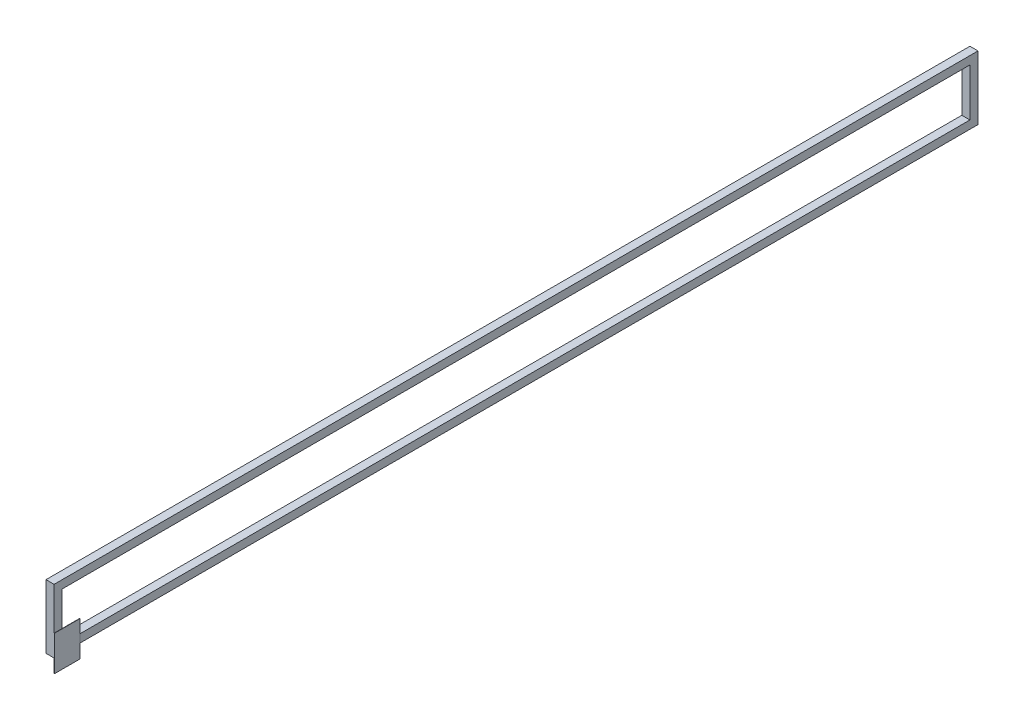
from build123d import *

# Parameters (mm, degrees)
CROQUIS1_W              = 50.8
CROQUIS1_H              = 50.8
SALIENTE_EXTRUIR1_DEPTH = 5800
CROQUIS4_W              = 160
CROQUIS4_H              = 220
SALIENTE_EXTRUIR4_DEPTH = 1.9
SALIENTE_EXTRUIR5_DEPTH = 50.8
CROQUIS7_W              = 50.8
CROQUIS7_H              = 299.2
SALIENTE_EXTRUIR7_DEPTH = 50.8


with BuildPart() as part:
    # Croquis1 → Saliente-Extruir1 (new body)
    with BuildSketch(Plane.XY):
        Rectangle(CROQUIS1_W, CROQUIS1_H)
    extrude(amount=SALIENTE_EXTRUIR1_DEPTH)

    # Croquis4 → Saliente-Extruir4 (add)
    with BuildSketch(Plane(origin=(25.4, 0, 0), x_dir=(0, 0, -1), z_dir=(1, 0, 0))):
        with Locations((-5720, 0)):
            Rectangle(CROQUIS4_W, CROQUIS4_H)
    extrude(amount=SALIENTE_EXTRUIR4_DEPTH)

    # Croquis5 → Saliente-Extruir5 (add)
    with BuildSketch(Plane(origin=(25.4, 0, 0), x_dir=(0, 0, -1), z_dir=(1, 0, 0))):
        Polygon((0, 25.4), (0, 375.4), (-5800, 375.4), (-5800, 324.6), (-50.8, 324.6), (-50.8, 25.4), align=None)
    extrude(amount=-SALIENTE_EXTRUIR5_DEPTH)

    # Croquis7 → Saliente-Extruir7 (add)
    with BuildSketch(Plane.ZY.offset(25.4)):
        with Locations((5774.6, 175)):
            Rectangle(CROQUIS7_W, CROQUIS7_H)
    extrude(amount=-SALIENTE_EXTRUIR7_DEPTH)


solid = part.part
